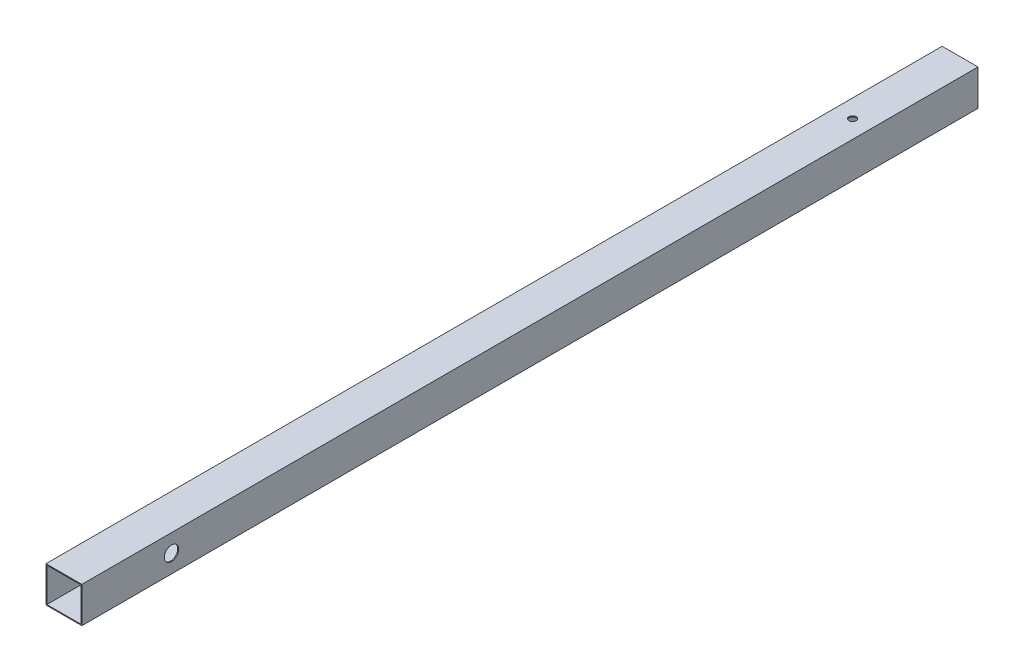
from build123d import *

# Parameters (mm, degrees)
SKETCH1_W           = 20
SKETCH1_H           = 20
BOSS_EXTRUDE1_DEPTH = 500
SKETCH2_W           = 19
SKETCH2_H           = 19
CUT_EXTRUDE1_DEPTH  = 501.199960016
SKETCH3_R           = 2
CUT_EXTRUDE2_DEPTH  = 20
SKETCH5_R           = 4
CUT_EXTRUDE3_DEPTH  = 20


with BuildPart() as part:
    # Sketch1 → Boss-Extrude1 (new body)
    with BuildSketch(Plane.XY):
        Rectangle(SKETCH1_W, SKETCH1_H)
    extrude(amount=BOSS_EXTRUDE1_DEPTH)

    # Sketch2 → Cut-Extrude1 (cut, through all)
    with BuildSketch(Plane(origin=(0, 0, 0), x_dir=(-1, 0, 0), z_dir=(0, 0, -1))):
        Rectangle(SKETCH2_W, SKETCH2_H)
    extrude(amount=-CUT_EXTRUDE1_DEPTH, mode=Mode.SUBTRACT)

    # Sketch3 → Cut-Extrude2 (cut)
    with BuildSketch(Plane(origin=(0, 10, 0), x_dir=(1, 0, 0), z_dir=(0, 1, 0))):
        with Locations(Location((0, -60, 0), (0, 0, 270))):
            Circle(SKETCH3_R)
    extrude(amount=-CUT_EXTRUDE2_DEPTH, mode=Mode.SUBTRACT)

    # Sketch5 → Cut-Extrude3 (cut)
    with BuildSketch(Plane.ZY.offset(10)):
        with Locations((450, 0)):
            Circle(SKETCH5_R)
    extrude(amount=-CUT_EXTRUDE3_DEPTH, mode=Mode.SUBTRACT)


solid = part.part
